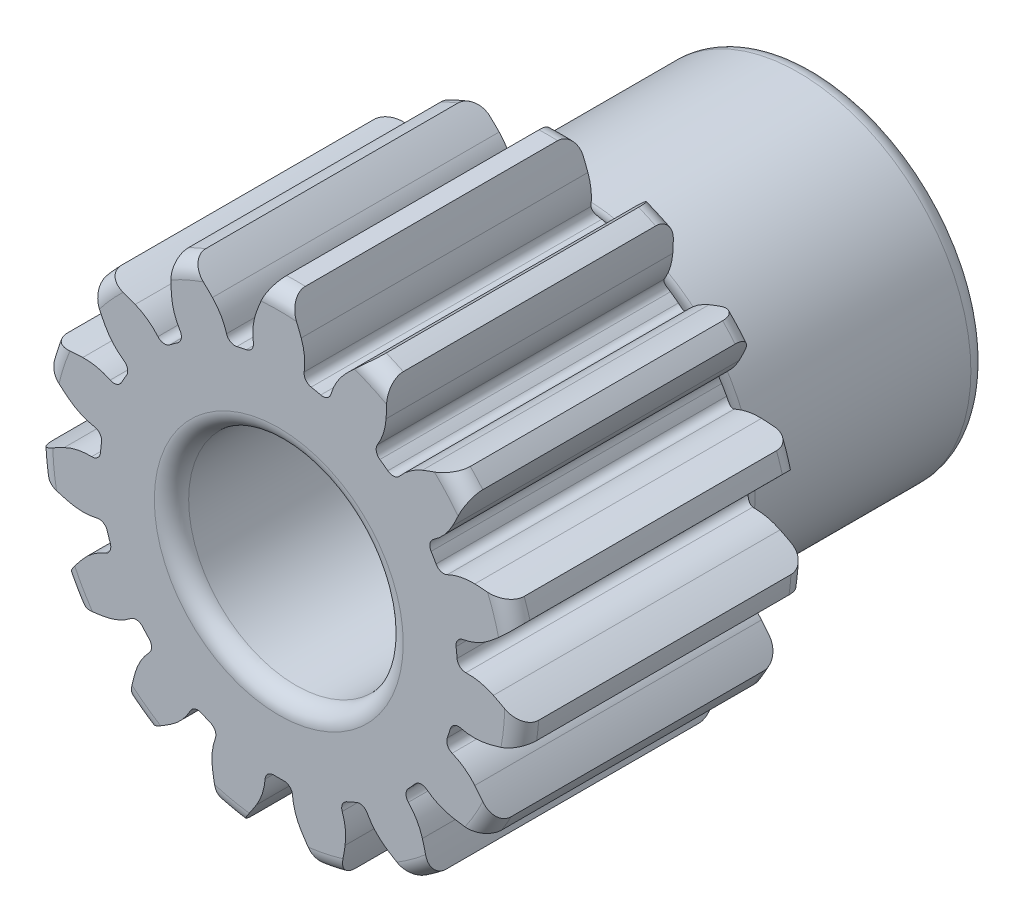
from build123d import *

# Parameters (mm, degrees)
CUT_EXTRUDE1_DEPTH = 29.296717251
CIRPATTERN1_COUNT  = 15


with BuildPart() as part:
    # Sketch3 → Revolve1 (revolve)
    with BuildSketch(Plane(origin=(0, 0, 0), x_dir=(0, 0, -1), z_dir=(1, 0, 0)), mode=Mode.PRIVATE) as revolve1_sk:
        with BuildLine():
            Line((11.1506, 4.7625), (-11.1506, 4.7625))
            ThreePointArc((-11.1506, 4.7625), (-11.689415367, 4.985684633), (-11.9126, 5.5245))
            Line((-11.9126, 5.5245), (-11.9126, 10.033))
            ThreePointArc((-11.9126, 10.033), (-11.689415367, 10.571815367), (-11.1506, 10.795))
            Line((-11.1506, 10.795), (0.0508, 10.795))
            ThreePointArc((0.0508, 10.795), (0.589615367, 10.571815367), (0.8128, 10.033))
            Line((0.8128, 10.033), (0.8128, 8.4201))
            ThreePointArc((0.8128, 8.4201), (1.035984633, 7.881284633), (1.5748, 7.6581))
            Line((1.5748, 7.6581), (11.1506, 7.6581))
            ThreePointArc((11.1506, 7.6581), (11.689415367, 7.434915367), (11.9126, 6.8961))
            Line((11.9126, 6.8961), (11.9126, 5.5245))
            ThreePointArc((11.9126, 5.5245), (11.689415367, 4.985684633), (11.1506, 4.7625))
        make_face()
    revolve(revolve1_sk.sketch.rotate(Axis((0, 0, -11.9126), (0, 0, 1)), 90), axis=Axis((0, 0, -11.9126), (0, 0, 1)))

    # Sketch4 → Cut-Extrude1 (cut, symmetric)
    with BuildSketch(Plane.XY.offset(11.9126)):
        with BuildLine():
            ThreePointArc((4.008209104, 10.023287125), (2.244406702, 10.55910335), (0.415156938, 10.787013939))
            ThreePointArc((0.415156938, 10.787013939), (0.727372782, 10.139624325), (0.995635932, 9.47282081))
            ThreePointArc((0.995635932, 9.47282081), (1.137463347, 8.860905082), (1.128124533, 8.232837681))
            ThreePointArc((1.128124533, 8.232837681), (1.196912561, 7.957786926), (1.436638553, 7.806406082))
            ThreePointArc((1.436638553, 7.806406082), (1.650299046, 7.764046581), (1.86271678, 7.715840359))
            ThreePointArc((1.86271678, 7.715840359), (2.143289507, 7.756628296), (2.318003718, 7.979921053))
            ThreePointArc((2.318003718, 7.979921053), (2.564930314, 8.557487612), (2.943384653, 9.058814038))
            ThreePointArc((2.943384653, 9.058814038), (3.459668659, 9.558856908), (4.008209104, 10.023287125))
        make_face()
    cut_extrude1 = extrude(amount=CUT_EXTRUDE1_DEPTH, both=True, mode=Mode.SUBTRACT)

    # CirPattern1: Cut-Extrude1 ×15 about axis
    cirpattern1_axis = Axis((0, 0, 0), (0, 0, 1))
    for i in range(1, CIRPATTERN1_COUNT):
        add(cut_extrude1.rotate(cirpattern1_axis, i * 360 / CIRPATTERN1_COUNT), mode=Mode.SUBTRACT)


solid = part.part
